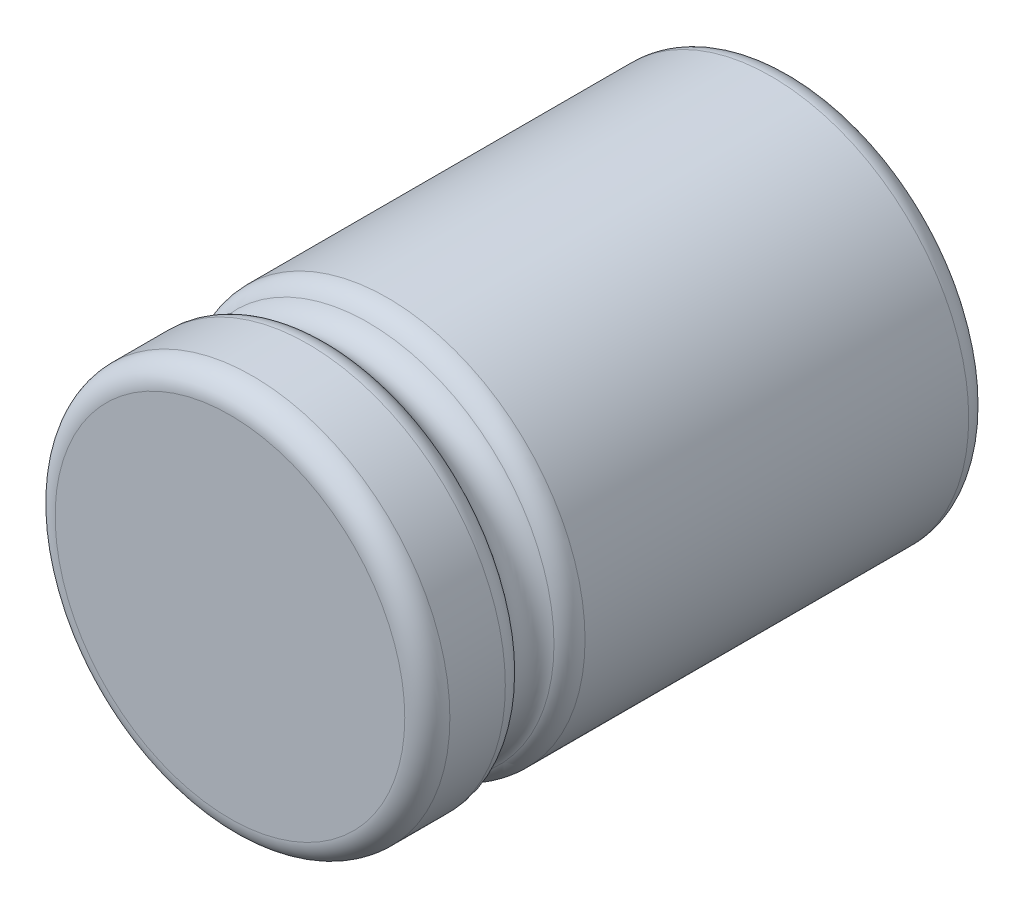
from build123d import *

# Parameters (mm, degrees)
SKETCH1_R           = 17.5
BOSS_EXTRUDE1_DEPTH = 50
FILLET1_R           = 2
SKETCH2_R           = 2.061113782
FILLET2_R           = 2


with BuildPart() as part:
    # Sketch1 → Boss-Extrude1 (new body)
    with BuildSketch(Plane.XY):
        Circle(SKETCH1_R)
    extrude(amount=BOSS_EXTRUDE1_DEPTH)

    # Fillet1
    fillet1_edges = [part.edges().sort_by_distance(p)[0] for p in [
        (-17.5, 0, 0),
        (-17.5, 0, 50),
    ]]
    fillet(fillet1_edges, radius=FILLET1_R)

    # Cut-Sweep1: sweep along a curve in space
    with BuildLine() as cut_sweep1_path:
        ThreePointArc((17.5, 0, 48), (12.374368671, 12.374368671, 48), (0, 17.5, 48))
        ThreePointArc((0, 17.5, 48), (-12.374368671, 12.374368671, 48), (-17.5, 0, 48))
        ThreePointArc((-17.5, 0, 48), (-12.374368671, -12.374368671, 48), (0, -17.5, 48))
        ThreePointArc((0, -17.5, 48), (12.374368671, -12.374368671, 48), (17.5, 0, 48))
    # Sketch2 → Cut-Sweep1 (sweep, cut)
    with BuildSketch(Plane(origin=(0, 0, 0), x_dir=(1, 0, 0), z_dir=(0, 1, 0))):
        with Locations((17.5, -39.550435004)):
            Circle(SKETCH2_R)
    sweep(path=cut_sweep1_path.line, mode=Mode.SUBTRACT)

    # Fillet2
    fillet2_edges = [part.edges().sort_by_distance(p)[0] for p in [
        (-12.374368671, -12.374368671, 41.611548785),
        (12.374368671, -12.374368671, 37.489321222),
    ]]
    fillet(fillet2_edges, radius=FILLET2_R)


solid = part.part
